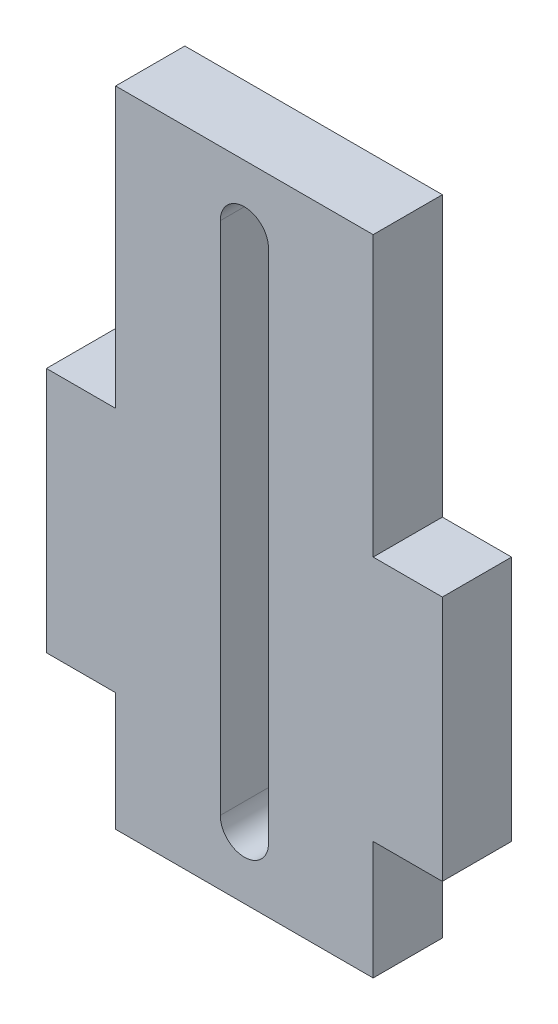
from build123d import *

# Parameters (mm, degrees)
BOSS_EXTRUDE1_DEPTH = 4.3


with BuildPart() as part:
    # Sketch1 → Boss-Extrude1 (new body)
    with BuildSketch(Plane.XY):
        Polygon((-8, 2.65), (-8, 20), (8, 20), (8, 2.65), (12.3, 2.65), (12.3, -12.65), (8, -12.65), (8, -20), (-8, -20), (-8, -12.65), (-12.3, -12.65), (-12.3, 2.65), align=None)
        with BuildLine():
            Line((-1.5, -16), (-1.5, 16))
            ThreePointArc((-1.5, 16), (0, 17.5), (1.5, 16))
            Line((1.5, 16), (1.5, -16))
            ThreePointArc((1.5, -16), (0, -17.5), (-1.5, -16))
        make_face(mode=Mode.SUBTRACT)
    extrude(amount=BOSS_EXTRUDE1_DEPTH)


solid = part.part
